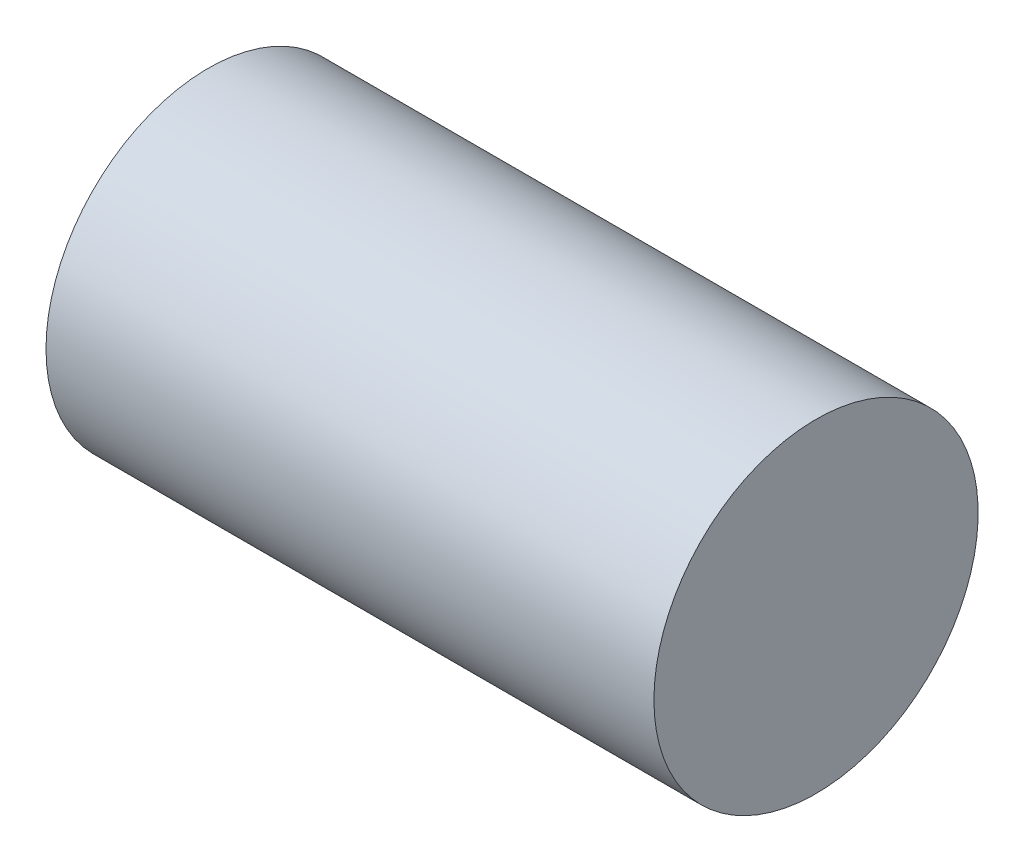
from build123d import *

# Parameters (mm, degrees)
AXIAL_BLANK_PROFILE_W = 30
AXIAL_BLANK_PROFILE_H = 8


with BuildPart() as part:
    # Axial blank profile → Native revolved blank (revolve)
    with BuildSketch(Plane.XY, mode=Mode.PRIVATE) as native_revolved_blank_sk:
        with Locations((-26, 4)):
            Rectangle(AXIAL_BLANK_PROFILE_W, AXIAL_BLANK_PROFILE_H)
    revolve(native_revolved_blank_sk.sketch.rotate(Axis((-60, 0, 0), (1, 0, 0)), 90), axis=Axis((-60, 0, 0), (1, 0, 0)))


solid = part.part
